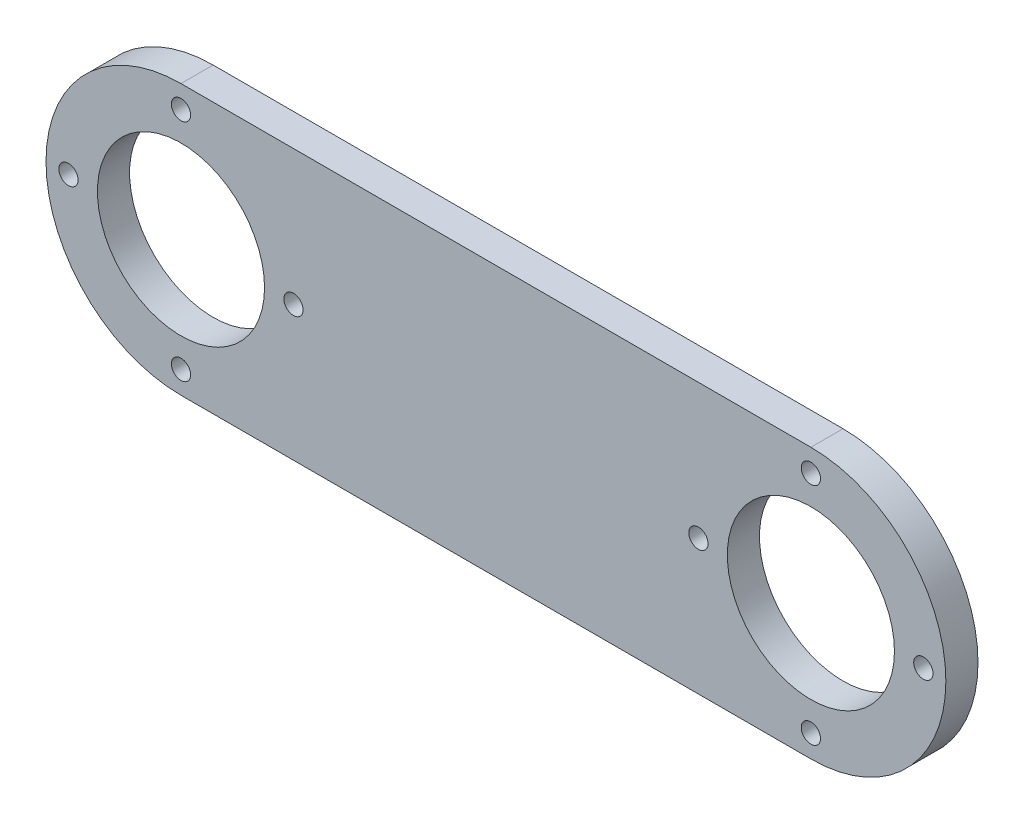
from build123d import *

# Parameters (mm, degrees)
SKETCH1_R           = 13
SKETCH1_R_2         = 1.5
BOSS_EXTRUDE1_DEPTH = 5


with BuildPart() as part:
    # Sketch1 → Boss-Extrude1 (new body)
    with BuildSketch(Plane.XY):
        with BuildLine():
            Line((49, 26), (-49, 26))
            ThreePointArc((-49, 26), (-70, 5), (-49, -16))
            Line((-49, -16), (49, -16))
            ThreePointArc((49, -16), (70, 5), (49, 26))
        make_face()
        with Locations((-49, 5)):
            Circle(SKETCH1_R, mode=Mode.SUBTRACT)
        with Locations((-66.5, 5)):
            Circle(SKETCH1_R_2, mode=Mode.SUBTRACT)
        with Locations((-49, 22.5)):
            Circle(SKETCH1_R_2, mode=Mode.SUBTRACT)
        with Locations((-31.5, 5)):
            Circle(SKETCH1_R_2, mode=Mode.SUBTRACT)
        with Locations((-49, -12.5)):
            Circle(SKETCH1_R_2, mode=Mode.SUBTRACT)
        with Locations((49, 5)):
            Circle(SKETCH1_R, mode=Mode.SUBTRACT)
        with Locations((31.5, 5)):
            Circle(SKETCH1_R_2, mode=Mode.SUBTRACT)
        with Locations((49, 22.5)):
            Circle(SKETCH1_R_2, mode=Mode.SUBTRACT)
        with Locations((66.5, 5)):
            Circle(SKETCH1_R_2, mode=Mode.SUBTRACT)
        with Locations((49, -12.5)):
            Circle(SKETCH1_R_2, mode=Mode.SUBTRACT)
    extrude(amount=BOSS_EXTRUDE1_DEPTH)


solid = part.part
